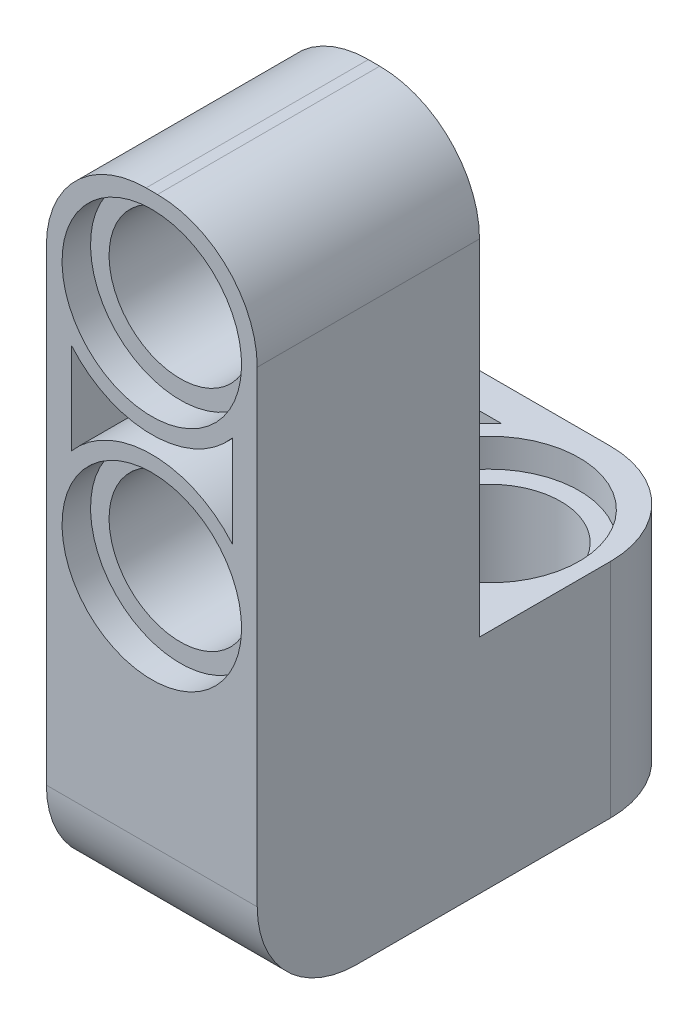
from build123d import *

# Parameters (mm, degrees)
SKETCH_3_W             = 0.1
SKETCH_3_H             = 7.8
SKETCH_3_W_2           = 8
EXTRUDE_1_DEPTH        = 7.4
CUT_EXTRUDE_1_REACH    = 22.97
SKETCH_4_R             = 2.5
SKETCH_4_3_R           = 3.15
SKETCH_4_3_R_2         = 2.5
CUT_EXTRUDE_2_DEPTH    = 1
CUT_EXTRUDE_START      = -6.8
SKETCH_4_4_R           = 3.15
SKETCH_4_4_R_2         = 2.5
CUT_EXTRUDE_3_DEPTH    = 1
SKETCH_5_R             = 2.5
CUT_EXTRUDE_4_DEPTH    = 26.844341741
SKETCH_5_3_R           = 3.15
SKETCH_5_3_R_2         = 2.5
CUT_EXTRUDE_5_DEPTH    = 1
SKETCH_5_4_R           = 3.15
SKETCH_5_4_R_2         = 2.5
CUT_EXTRUDE_6_DEPTH    = 1
CUT_EXTRUDE_9_DEPTH    = 2
CUT_EXTRUDE_START_2    = -5.8
CUT_EXTRUDE_10_DEPTH   = 2
PATTERN_LINEAR_1_COUNT = 2
PATTERN_LINEAR_1_PITCH = 8
SKETCH_7_W             = 7.95
SKETCH_7_H             = 7.8
EXTRUDE_2_DEPTH        = 7.8
PATTERN_LINEAR_2_COUNT = 2
PATTERN_LINEAR_2_PITCH = 8
CUT_EXTRUDE_11_DEPTH   = 2
CUT_EXTRUDE_12_DEPTH   = 2
FILLET_1_R             = 3.5


with BuildPart() as part:
    # 草图3 → 凸台-拉伸1 (new body)
    with BuildSketch(Plane(origin=(0, 0, 0), x_dir=(0, 0, -1), z_dir=(1, 0, 0))):
        with Locations((-4.05, 3.9)):
            Rectangle(SKETCH_3_W, SKETCH_3_H)
        Polygon((-11.9, 0), (-4.1, 0), (-4.1, 7.8), (-4.1, 23.4), (-11.9, 23.4), align=None)
        with Locations((0, 3.9)):
            Rectangle(SKETCH_3_W_2, SKETCH_3_H)
    extrude(amount=EXTRUDE_1_DEPTH)

    # 草图4 → 切除-拉伸1 (cut, up to next)
    with BuildSketch(Plane(origin=(0, 7.8, 0), x_dir=(1, 0, 0), z_dir=(0, 1, 0)), mode=Mode.PRIVATE) as cut_extrude_1_sk1:
        with Locations(Location((3.7, -0.05, 0), (0, 0, 270))):
            Circle(SKETCH_4_R)
    cut_extrude_1_tool1 = extrude(cut_extrude_1_sk1.sketch, amount=-CUT_EXTRUDE_1_REACH, mode=Mode.PRIVATE) & part.part
    cut_extrude_1 = cut_extrude_1_tool1.solids().sort_by_distance((3.7, 7.8, 0.05))[0]
    add(cut_extrude_1, mode=Mode.SUBTRACT)

    # 草图4<3> → 切除-拉伸2 (cut)
    with BuildSketch(Plane(origin=(0, 7.8, 0), x_dir=(1, 0, 0), z_dir=(0, 1, 0))):
        with Locations(Location((3.7, -0.05, 0), (0, 0, 270))):
            Circle(SKETCH_4_3_R)
        with Locations(Location((3.7, -0.05, 0), (0, 0, 270))):
            Circle(SKETCH_4_3_R_2, mode=Mode.SUBTRACT)
    cut_extrude_2 = extrude(amount=-CUT_EXTRUDE_2_DEPTH, mode=Mode.SUBTRACT)

    # 草图4<4> → 切除-拉伸3 (cut)
    with BuildSketch(Plane(origin=(0, 7.8, 0), x_dir=(1, 0, 0), z_dir=(0, 1, 0)).offset(CUT_EXTRUDE_START)):
        with Locations(Location((3.7, -0.05, 0), (0, 0, 270))):
            Circle(SKETCH_4_4_R)
        with Locations(Location((3.7, -0.05, 0), (0, 0, 270))):
            Circle(SKETCH_4_4_R_2, mode=Mode.SUBTRACT)
    cut_extrude_3 = extrude(amount=-CUT_EXTRUDE_3_DEPTH, mode=Mode.SUBTRACT)

    # 草图5 → 切除-拉伸4 (cut, through all)
    with BuildSketch(Plane(origin=(0, 0, 4.1), x_dir=(-1, 0, 0), z_dir=(0, 0, -1))):
        with Locations(Location((-3.7, 11.7, 0), (0, 0, 90))):
            Circle(SKETCH_5_R)
    cut_extrude_4 = extrude(amount=-CUT_EXTRUDE_4_DEPTH, mode=Mode.SUBTRACT)

    # 草图5<3> → 切除-拉伸5 (cut)
    with BuildSketch(Plane(origin=(0, 0, 4.1), x_dir=(-1, 0, 0), z_dir=(0, 0, -1))):
        with Locations(Location((-3.7, 11.7, 0), (0, 0, 90))):
            Circle(SKETCH_5_3_R)
        with Locations(Location((-3.7, 11.7, 0), (0, 0, 90))):
            Circle(SKETCH_5_3_R_2, mode=Mode.SUBTRACT)
    cut_extrude_5 = extrude(amount=-CUT_EXTRUDE_5_DEPTH, mode=Mode.SUBTRACT)

    # 草图5<4> → 切除-拉伸6 (cut)
    with BuildSketch(Plane(origin=(0, 0, 4.1), x_dir=(-1, 0, 0), z_dir=(0, 0, -1)).offset(CUT_EXTRUDE_START)):
        with Locations(Location((-3.7, 11.7, 0), (0, 0, 90))):
            Circle(SKETCH_5_4_R)
        with Locations(Location((-3.7, 11.7, 0), (0, 0, 90))):
            Circle(SKETCH_5_4_R_2, mode=Mode.SUBTRACT)
    cut_extrude_6 = extrude(amount=-CUT_EXTRUDE_6_DEPTH, mode=Mode.SUBTRACT)

    # 草图6 → 切除-拉伸9 (cut)
    with BuildSketch(Plane(origin=(0, 0, 4.1), x_dir=(-1, 0, 0), z_dir=(0, 0, -1))):
        with BuildLine():
            ThreePointArc((-6.525, 14.089429848), (-3.7, 15.4), (-0.875, 14.089429848))
            Line((-0.875, 14.089429848), (-0.875, 17.310570152))
            ThreePointArc((-0.875, 17.310570152), (-3.7, 16), (-6.525, 17.310570152))
            Line((-6.525, 17.310570152), (-6.525, 14.089429848))
        make_face()
    extrude(amount=-CUT_EXTRUDE_9_DEPTH, mode=Mode.SUBTRACT)

    # 草图6<3> → 切除-拉伸10 (cut)
    with BuildSketch(Plane(origin=(0, 0, 4.1), x_dir=(-1, 0, 0), z_dir=(0, 0, -1)).offset(CUT_EXTRUDE_START_2)):
        with BuildLine():
            ThreePointArc((-6.525, 14.089429848), (-3.7, 15.4), (-0.875, 14.089429848))
            Line((-0.875, 14.089429848), (-0.875, 17.310570152))
            ThreePointArc((-0.875, 17.310570152), (-3.7, 16), (-6.525, 17.310570152))
            Line((-6.525, 17.310570152), (-6.525, 14.089429848))
        make_face()
    extrude(amount=-CUT_EXTRUDE_10_DEPTH, mode=Mode.SUBTRACT)

    # 阵列(线性)1: 切除-拉伸4, 切除-拉伸5, 切除-拉伸6 ×2
    with Locations(*[(0, i * PATTERN_LINEAR_1_PITCH, 0) for i in range(1, PATTERN_LINEAR_1_COUNT)]):
        add(cut_extrude_4, mode=Mode.SUBTRACT)
        add(cut_extrude_5, mode=Mode.SUBTRACT)
        add(cut_extrude_6, mode=Mode.SUBTRACT)

    # 草图7 → 凸台-拉伸2 (add)
    with BuildSketch(Plane(origin=(0, 0, 0), x_dir=(0, 0, -1), z_dir=(1, 0, 0))):
        with Locations((0.025, 3.9)):
            Rectangle(SKETCH_7_W, SKETCH_7_H)
    extrude(amount=-EXTRUDE_2_DEPTH)

    # 阵列(线性)2: 切除-拉伸1, 切除-拉伸2, 切除-拉伸3 ×2
    with Locations(*[(-i * PATTERN_LINEAR_2_PITCH, 0, 0) for i in range(1, PATTERN_LINEAR_2_COUNT)]):
        add(cut_extrude_1, mode=Mode.SUBTRACT)
        add(cut_extrude_2, mode=Mode.SUBTRACT)
        add(cut_extrude_3, mode=Mode.SUBTRACT)

    # 草图9 → 切除-拉伸11 (cut)
    with BuildSketch(Plane.XZ):
        with BuildLine():
            ThreePointArc((0, 0.05), (0.343596386, 1.607098192), (1.310570152, 2.875))
            Line((1.310570152, 2.875), (-1.910570152, 2.875))
            ThreePointArc((-1.910570152, 2.875), (-0.943596386, 1.607098192), (-0.6, 0.05))
            Line((-0.6, 0.05), (0, 0.05))
        make_face()
        with BuildLine():
            Line((-1.910570152, -2.775), (1.310570152, -2.775))
            ThreePointArc((1.310570152, -2.775), (0.343596386, -1.507098192), (0, 0.05))
            Line((0, 0.05), (-0.6, 0.05))
            ThreePointArc((-0.6, 0.05), (-0.943596386, -1.507098192), (-1.910570152, -2.775))
        make_face()
    extrude(amount=-CUT_EXTRUDE_11_DEPTH, mode=Mode.SUBTRACT)

    # 草图9<3> → 切除-拉伸12 (cut)
    with BuildSketch(Plane.XZ.offset(CUT_EXTRUDE_START_2)):
        with BuildLine():
            ThreePointArc((0, 0.05), (0.343596386, 1.607098192), (1.310570152, 2.875))
            Line((1.310570152, 2.875), (-1.910570152, 2.875))
            ThreePointArc((-1.910570152, 2.875), (-0.943596386, 1.607098192), (-0.6, 0.05))
            Line((-0.6, 0.05), (0, 0.05))
        make_face()
        with BuildLine():
            Line((-1.910570152, -2.775), (1.310570152, -2.775))
            ThreePointArc((1.310570152, -2.775), (0.343596386, -1.507098192), (0, 0.05))
            Line((0, 0.05), (-0.6, 0.05))
            ThreePointArc((-0.6, 0.05), (-0.943596386, -1.507098192), (-1.910570152, -2.775))
        make_face()
    extrude(amount=-CUT_EXTRUDE_12_DEPTH, mode=Mode.SUBTRACT)

    # 圆角1
    fillet_1_edges = [part.edges().sort_by_distance(p)[0] for p in [
        (7.4, 23.4, 8),
        (0, 23.4, 8),
        (-7.8, 3.9, -4),
        (-7.8, 3.9, 3.95),
        (3.7, 0, 11.9),
        (7.4, 3.9, -4),
    ]]
    fillet(fillet_1_edges, radius=FILLET_1_R)


solid = part.part
